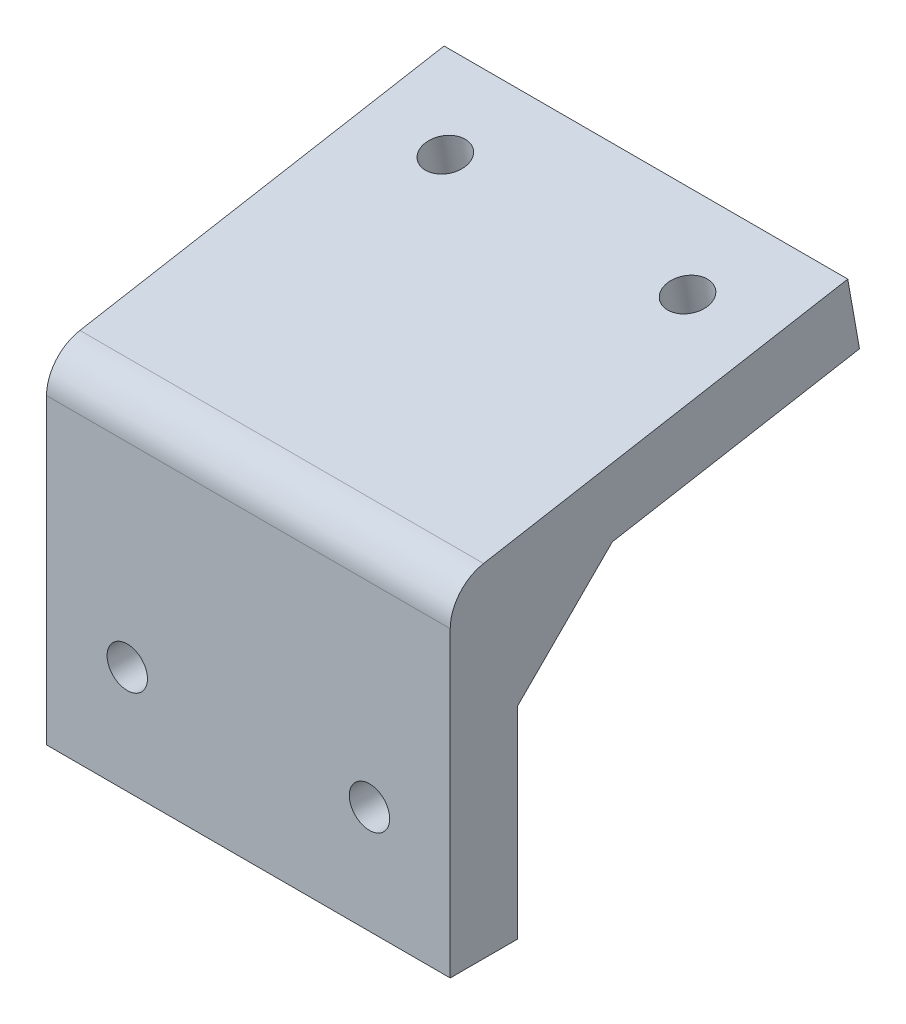
from build123d import *

# Parameters (mm, degrees)
EXTRUDE_1_DEPTH     = 30
FILLET_1_R          = 3
SKETCH_2_R          = 1.5
CUT_EXTRUDE_1_DEPTH = 53.32140222
SKETCH_3_R          = 1.5
CUT_EXTRUDE_2_DEPTH = 52.875952527
EXTRUDE_2_DEPTH     = 30


with BuildPart() as part:
    # 草图1 → 凸台-拉伸1 (new body)
    with BuildSketch(Plane(origin=(0, 0, 0), x_dir=(0, 0, -1), z_dir=(1, 0, 0))):
        Polygon((0, 0), (5, 0), (5, 20.804501844), (30.412473479, 25.285406565), (29.54423259, 30.20944533), (0, 25), align=None)
    extrude(amount=EXTRUDE_1_DEPTH)

    # 圆角1
    fillet_1_edges = [part.edges().sort_by_distance(p)[0] for p in [
        (15, 25, 0),
        (15, 20.804501844, -5),
    ]]
    fillet(fillet_1_edges, radius=FILLET_1_R)

    # 草图2 → 切除-拉伸1 (cut, through all)
    with BuildSketch(Plane.XY):
        with Locations((6, 8)):
            Circle(SKETCH_2_R)
        with Locations((24, 8)):
            Circle(SKETCH_2_R)
    extrude(amount=-CUT_EXTRUDE_1_DEPTH, mode=Mode.SUBTRACT)

    # 草图3 → 切除-拉伸2 (cut, through all)
    with BuildSketch(Plane(origin=(0, 24.24615776, 4.275251792), x_dir=(1, 0, 0), z_dir=(0, 0.9848077530122086, 0.1736481776669273))):
        with Locations(Location((6, 28.341204442, 0), (0, 0, 270))):
            Circle(SKETCH_3_R)
        with Locations(Location((24, 28.341204442, 0), (0, 0, 270))):
            Circle(SKETCH_3_R)
    extrude(amount=-CUT_EXTRUDE_2_DEPTH, mode=Mode.SUBTRACT)

    # 草图4 → 凸台-拉伸2 (add)
    with BuildSketch(Plane(origin=(30, 0, 0), x_dir=(0, 0, -1), z_dir=(1, 0, 0))):
        with BuildLine():
            Line((5, 15), (5, 18.287202951))
            ThreePointArc((5, 18.287202951), (5.701866671, 20.21556578), (7.479055467, 21.24162621))
            Line((7.479055467, 21.24162621), (12.047094791, 22.047094791))
            Line((12.047094791, 22.047094791), (5, 15))
        make_face()
    extrude(amount=-EXTRUDE_2_DEPTH)


solid = part.part
